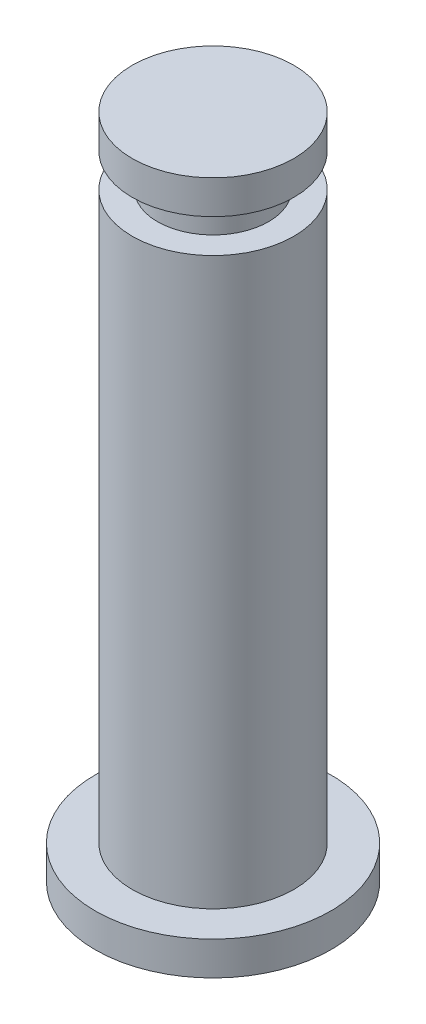
from build123d import *

# Parameters (mm, degrees)
CROQUIS1_R              = 3.5
CROQUIS1_R_2            = 2.4
SALIENTE_EXTRUIR1_DEPTH = 1
CROQUIS1_2_R            = 2.4
SALIENTE_EXTRUIR2_DEPTH = 19.8
CORTAR_EXTRUIR1_START   = -2
CROQUIS2_R              = 2.4
CROQUIS2_R_2            = 1.65
CORTAR_EXTRUIR1_DEPTH   = 1


with BuildPart() as part:
    # Croquis1 → Saliente-Extruir1 (new body)
    with BuildSketch(Plane(origin=(0, 0, 0), x_dir=(1, 0, 0), z_dir=(0, 1, 0))):
        Circle(CROQUIS1_R)
        Circle(CROQUIS1_R_2, mode=Mode.SUBTRACT)
    extrude(amount=SALIENTE_EXTRUIR1_DEPTH)

    # Croquis1<2> → Saliente-Extruir2 (add)
    with BuildSketch(Plane(origin=(0, 0, 0), x_dir=(1, 0, 0), z_dir=(0, 1, 0))):
        Circle(CROQUIS1_2_R)
    extrude(amount=SALIENTE_EXTRUIR2_DEPTH)

    # Croquis2 → Cortar-Extruir1 (cut)
    with BuildSketch(Plane(origin=(0, 19.8, 0), x_dir=(1, 0, 0), z_dir=(0, 1, 0)).offset(CORTAR_EXTRUIR1_START)):
        Circle(CROQUIS2_R)
        Circle(CROQUIS2_R_2, mode=Mode.SUBTRACT)
    extrude(amount=CORTAR_EXTRUIR1_DEPTH, mode=Mode.SUBTRACT)


solid = part.part
